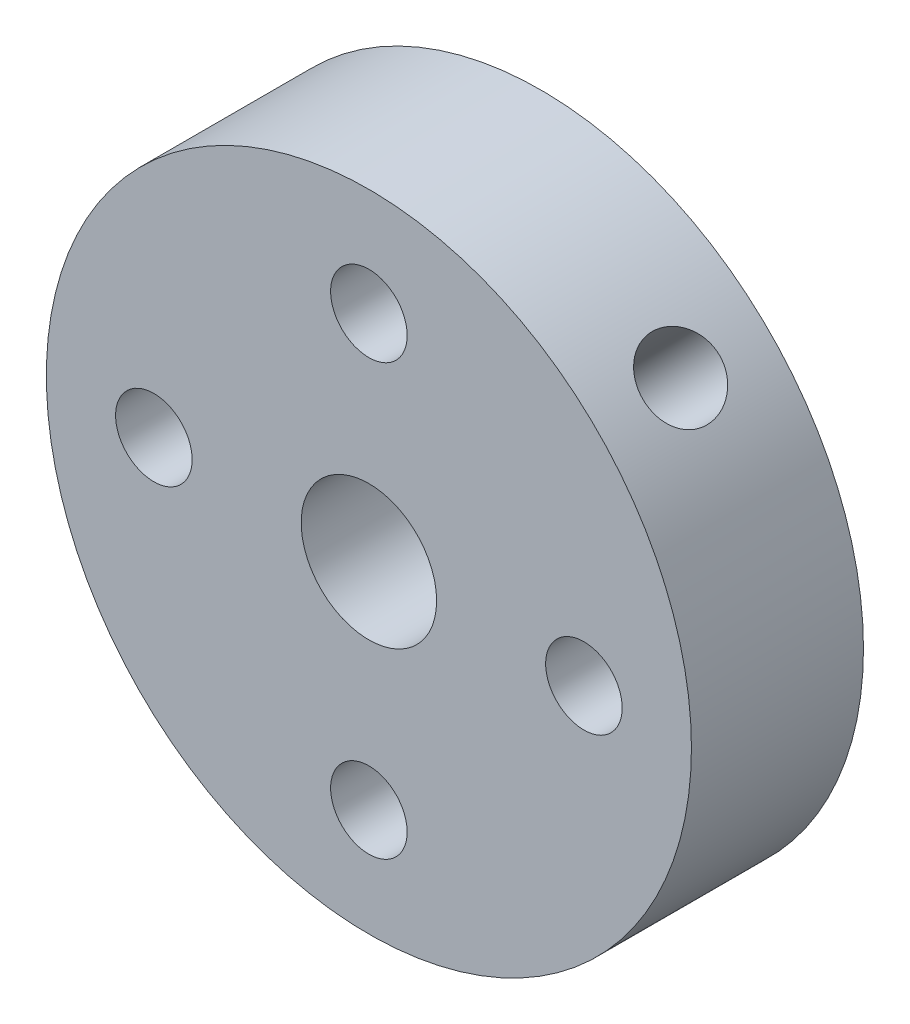
from build123d import *

# Parameters (mm, degrees)
SKETCH1_R                 = 9.525
SKETCH1_R_2               = 2
BOSS_EXTRUDE1_DEPTH       = 5.08
F_4_40_TAPPED_HOLE3_D     = 2.2606
F_4_40_TAPPED_HOLE3_DEPTH = 7.6
F_4_40_TAPPED_HOLE3_TIP   = 0.679152758
F_4_40_TAPPED_HOLE2_D     = 2.2606
F_4_40_TAPPED_HOLE2_DEPTH = 7.6
F_4_40_TAPPED_HOLE2_TIP   = 0.679152758


with BuildPart() as part:
    # Sketch1 → Boss-Extrude1 (new body)
    with BuildSketch(Plane.XY):
        Circle(SKETCH1_R)
        Circle(SKETCH1_R_2, mode=Mode.SUBTRACT)
    extrude(amount=BOSS_EXTRUDE1_DEPTH)

    # #4-40 Tapped Hole3
    with Locations(Plane.XY.offset(5.08)):
        with Locations((-6.35, 0), (6.35, 0), (0, 6.35), (0, -6.35)):
            Hole(F_4_40_TAPPED_HOLE3_D / 2, depth=F_4_40_TAPPED_HOLE3_DEPTH)
            with Locations((0, 0, -(F_4_40_TAPPED_HOLE3_DEPTH + F_4_40_TAPPED_HOLE3_TIP / 2))):  # 118° drill point
                Cone(0, F_4_40_TAPPED_HOLE3_D / 2, F_4_40_TAPPED_HOLE3_TIP, mode=Mode.SUBTRACT)

    # #4-40 Tapped Hole2
    with Locations(Plane(origin=(6.681738172, 6.788225099, 2.54), x_dir=(0.712674551117, -0.701494821214, 0), z_dir=(0.701494821214, 0.712674551117, 0))):
        with Locations((0, 0)):
            Hole(F_4_40_TAPPED_HOLE2_D / 2, depth=F_4_40_TAPPED_HOLE2_DEPTH)
            with Locations((0, 0, -(F_4_40_TAPPED_HOLE2_DEPTH + F_4_40_TAPPED_HOLE2_TIP / 2))):  # 118° drill point
                Cone(0, F_4_40_TAPPED_HOLE2_D / 2, F_4_40_TAPPED_HOLE2_TIP, mode=Mode.SUBTRACT)


solid = part.part
